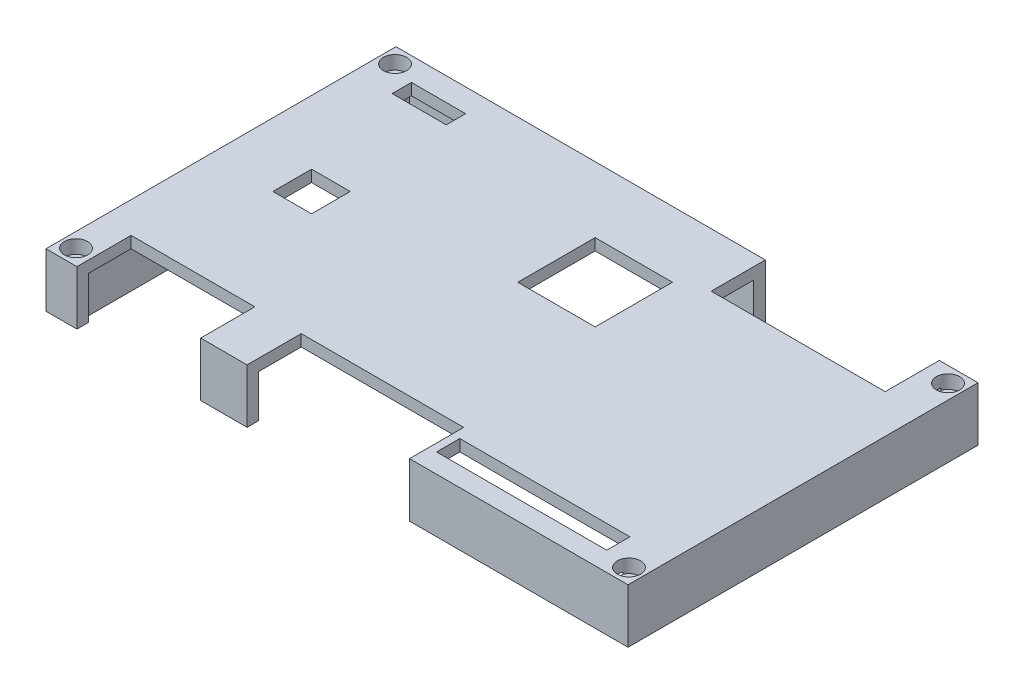
from build123d import *

# Parameters (mm, degrees)
SKETCH1_W           = 150.5
SKETCH1_H           = 90.5
BOSS_EXTRUDE1_DEPTH = 3
SKETCH2_W           = 150.5
SKETCH2_H           = 90.5
SKETCH2_W_2         = 137.5
SKETCH2_H_2         = 84.5
BOSS_EXTRUDE2_DEPTH = 11
SKETCH3_R           = 1.5
CUT_EXTRUDE1_DEPTH  = 31
SKETCH4_R           = 3
CUT_EXTRUDE2_DEPTH  = 3.5
SKETCH5_W           = 32
SKETCH5_H           = 14
SKETCH5_W_2         = 42
SKETCH5_W_3         = 44
SKETCH5_H_2         = 6
SKETCH5_W_4         = 45
SKETCH5_W_5         = 20
SKETCH5_H_3         = 20
SKETCH5_W_6         = 14
SKETCH5_H_4         = 5
SKETCH5_W_7         = 10
SKETCH5_H_5         = 10
CUT_EXTRUDE3_DEPTH  = 15
SKETCH7_W           = 40
SKETCH7_H           = 9
CUT_EXTRUDE4_DEPTH  = 15


with BuildPart() as part:
    # Sketch1 → Boss-Extrude1 (new body)
    with BuildSketch(Plane(origin=(0, 0, 0), x_dir=(1, 0, 0), z_dir=(0, 1, 0))):
        Rectangle(SKETCH1_W, SKETCH1_H)
    extrude(amount=BOSS_EXTRUDE1_DEPTH)

    # Sketch2 → Boss-Extrude2 (add)
    with BuildSketch(Plane(origin=(0, 0, 0), x_dir=(-1, 0, 0), z_dir=(0, -1, 0))):
        Rectangle(SKETCH2_W, SKETCH2_H)
        Rectangle(SKETCH2_W_2, SKETCH2_H_2, mode=Mode.SUBTRACT)
    extrude(amount=BOSS_EXTRUDE2_DEPTH)

    # Sketch3 → Cut-Extrude1 (cut)
    with BuildSketch(Plane(origin=(0, 3, 0), x_dir=(1, 0, 0), z_dir=(0, 1, 0))):
        with Locations(Location((-71.5, 41.25, 0), (0, 0, 270))):
            Circle(SKETCH3_R)
        with Locations(Location((-71.5, -41.25, 0), (0, 0, 270))):
            Circle(SKETCH3_R)
        with Locations(Location((71.5, -41.25, 0), (0, 0, 270))):
            Circle(SKETCH3_R)
        with Locations(Location((71.5, 41.25, 0), (0, 0, 270))):
            Circle(SKETCH3_R)
    extrude(amount=-CUT_EXTRUDE1_DEPTH, mode=Mode.SUBTRACT)

    # Sketch4 → Cut-Extrude2 (cut)
    with BuildSketch(Plane(origin=(0, 3, 0), x_dir=(1, 0, 0), z_dir=(0, 1, 0))):
        with Locations(Location((-71.5, 41.25, 0), (0, 0, 270))):
            Circle(SKETCH4_R)
        with Locations(Location((-71.5, -41.25, 0), (0, 0, 270))):
            Circle(SKETCH4_R)
        with Locations(Location((71.5, -41.25, 0), (0, 0, 270))):
            Circle(SKETCH4_R)
        with Locations(Location((71.5, 41.25, 0), (0, 0, 270))):
            Circle(SKETCH4_R)
    extrude(amount=-CUT_EXTRUDE2_DEPTH, mode=Mode.SUBTRACT)

    # Sketch5 → Cut-Extrude3 (cut)
    with BuildSketch(Plane(origin=(0, 3, 0), x_dir=(1, 0, 0), z_dir=(0, 1, 0))):
        with Locations((-51.25, -38.25)):
            Rectangle(SKETCH5_W, SKETCH5_H)
        with Locations((-2.25, -38.25)):
            Rectangle(SKETCH5_W_2, SKETCH5_H)
        with Locations((42.75, -37.25)):
            Rectangle(SKETCH5_W_3, SKETCH5_H_2)
        with Locations((42.75, 38.25)):
            Rectangle(SKETCH5_W_4, SKETCH5_H)
        with Locations((3.25, 18.25)):
            Rectangle(SKETCH5_W_5, SKETCH5_H_3)
        with Locations((-58.25, 36.75)):
            Rectangle(SKETCH5_W_6, SKETCH5_H_4)
        with Locations((-53.744307693, 1.912180937)):
            Rectangle(SKETCH5_W_7, SKETCH5_H_5)
    extrude(amount=-CUT_EXTRUDE3_DEPTH, mode=Mode.SUBTRACT)

    # Sketch7 → Cut-Extrude4 (cut)
    with BuildSketch(Plane.ZY.offset(75.25)):
        with Locations((-14.171893674, -6.5)):
            Rectangle(SKETCH7_W, SKETCH7_H)
    extrude(amount=-CUT_EXTRUDE4_DEPTH, mode=Mode.SUBTRACT)


solid = part.part
